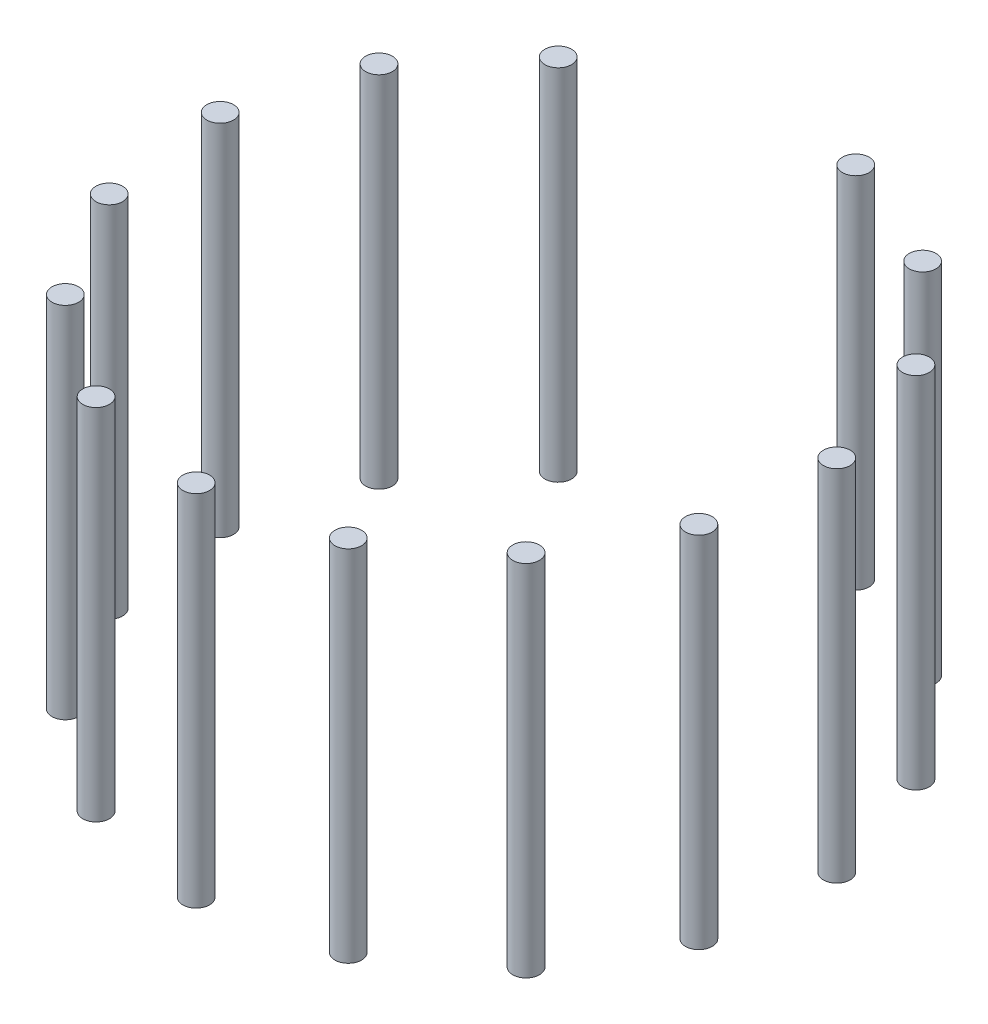
from build123d import *

# Parameters (mm, degrees)
SKETCH1_R              = 0.35
BOSS_EXTRUDE1_DEPTH    = 9.4
BOSS_EXTRUDE1_2_DEPTH  = 9.4
BOSS_EXTRUDE1_3_DEPTH  = 9.4
BOSS_EXTRUDE1_4_DEPTH  = 9.4
BOSS_EXTRUDE1_5_DEPTH  = 9.4
BOSS_EXTRUDE1_6_DEPTH  = 9.4
BOSS_EXTRUDE1_7_DEPTH  = 9.4
BOSS_EXTRUDE1_8_DEPTH  = 9.4
BOSS_EXTRUDE1_9_DEPTH  = 9.4
BOSS_EXTRUDE1_10_DEPTH = 9.4
BOSS_EXTRUDE1_11_DEPTH = 9.4
BOSS_EXTRUDE1_12_DEPTH = 9.4
BOSS_EXTRUDE1_13_DEPTH = 9.4
BOSS_EXTRUDE1_14_DEPTH = 9.4


with BuildPart() as part:
    # Sketch1 → Boss-Extrude1 (new body)
    with BuildSketch(Plane(origin=(0, 0, 0), x_dir=(1, 0, 0), z_dir=(0, 1, 0))):
        with Locations(Location((15.176802475, 8.12525881, 0), (0, 0, 270))):
            Circle(SKETCH1_R)
    extrude(amount=BOSS_EXTRUDE1_DEPTH)


with BuildPart() as body_2:
    # Sketch1 → Boss-Extrude1 2 (new body)
    with BuildSketch(Plane(origin=(0, 0, 0), x_dir=(1, 0, 0), z_dir=(0, 1, 0))):
        with Locations(Location((18.235691658, 6.817826829, 0), (0, 0, 270))):
            Circle(SKETCH1_R)
    extrude(amount=BOSS_EXTRUDE1_2_DEPTH)


with BuildPart() as body_3:
    # Sketch1 → Boss-Extrude1 3 (new body)
    with BuildSketch(Plane(origin=(0, 0, 0), x_dir=(1, 0, 0), z_dir=(0, 1, 0))):
        with Locations(Location((20.498345482, 4.379265963, 0), (0, 0, 270))):
            Circle(SKETCH1_R)
    extrude(amount=BOSS_EXTRUDE1_3_DEPTH)


with BuildPart() as body_4:
    # Sketch1 → Boss-Extrude1 4 (new body)
    with BuildSketch(Plane(origin=(0, 0, 0), x_dir=(1, 0, 0), z_dir=(0, 1, 0))):
        with Locations(Location((21.573530543, 1.23122554, 0), (0, 0, 270))):
            Circle(SKETCH1_R)
    extrude(amount=BOSS_EXTRUDE1_4_DEPTH)


with BuildPart() as body_5:
    # Sketch1 → Boss-Extrude1 5 (new body)
    with BuildSketch(Plane(origin=(0, 0, 0), x_dir=(1, 0, 0), z_dir=(0, 1, 0))):
        with Locations(Location((21.275337579, -2.081969652, 0), (0, 0, 270))):
            Circle(SKETCH1_R)
    extrude(amount=BOSS_EXTRUDE1_5_DEPTH)


with BuildPart() as body_6:
    # Sketch1 → Boss-Extrude1 6 (new body)
    with BuildSketch(Plane(origin=(0, 0, 0), x_dir=(1, 0, 0), z_dir=(0, 1, 0))):
        with Locations(Location((19.655326861, -4.987438064, 0), (0, 0, 270))):
            Circle(SKETCH1_R)
    extrude(amount=BOSS_EXTRUDE1_6_DEPTH)


with BuildPart() as body_7:
    # Sketch1 → Boss-Extrude1 7 (new body)
    with BuildSketch(Plane(origin=(0, 0, 0), x_dir=(1, 0, 0), z_dir=(0, 1, 0))):
        with Locations(Location((16.993612959, -6.982797813, 0), (0, 0, 270))):
            Circle(SKETCH1_R)
    extrude(amount=BOSS_EXTRUDE1_7_DEPTH)


with BuildPart() as body_8:
    # Sketch1 → Boss-Extrude1 8 (new body)
    with BuildSketch(Plane(origin=(0, 0, 0), x_dir=(1, 0, 0), z_dir=(0, 1, 0))):
        with Locations(Location((13.750430389, -7.723033071, 0), (0, 0, 270))):
            Circle(SKETCH1_R)
    extrude(amount=BOSS_EXTRUDE1_8_DEPTH)


with BuildPart() as body_9:
    # Sketch1 → Boss-Extrude1 9 (new body)
    with BuildSketch(Plane(origin=(0, 0, 0), x_dir=(1, 0, 0), z_dir=(0, 1, 0))):
        with Locations(Location((10.48655488, -7.080150437, 0), (0, 0, 270))):
            Circle(SKETCH1_R)
    extrude(amount=BOSS_EXTRUDE1_9_DEPTH)


with BuildPart() as body_10:
    # Sketch1 → Boss-Extrude1 10 (new body)
    with BuildSketch(Plane(origin=(0, 0, 0), x_dir=(1, 0, 0), z_dir=(0, 1, 0))):
        with Locations(Location((7.766340158, -5.165310159, 0), (0, 0, 270))):
            Circle(SKETCH1_R)
    extrude(amount=BOSS_EXTRUDE1_10_DEPTH)


with BuildPart() as body_11:
    # Sketch1 → Boss-Extrude1 11 (new body)
    with BuildSketch(Plane(origin=(0, 0, 0), x_dir=(1, 0, 0), z_dir=(0, 1, 0))):
        with Locations(Location((6.060136062, -2.309605516, 0), (0, 0, 270))):
            Circle(SKETCH1_R)
    extrude(amount=BOSS_EXTRUDE1_11_DEPTH)


with BuildPart() as body_12:
    # Sketch1 → Boss-Extrude1 12 (new body)
    with BuildSketch(Plane(origin=(0, 0, 0), x_dir=(1, 0, 0), z_dir=(0, 1, 0))):
        with Locations(Location((5.662960781, 0.993186215, 0), (0, 0, 270))):
            Circle(SKETCH1_R)
    extrude(amount=BOSS_EXTRUDE1_12_DEPTH)


with BuildPart() as body_13:
    # Sketch1 → Boss-Extrude1 13 (new body)
    with BuildSketch(Plane(origin=(0, 0, 0), x_dir=(1, 0, 0), z_dir=(0, 1, 0))):
        with Locations(Location((6.643489528, 4.171982339, 0), (0, 0, 270))):
            Circle(SKETCH1_R)
    extrude(amount=BOSS_EXTRUDE1_13_DEPTH)


with BuildPart() as body_14:
    # Sketch1 → Boss-Extrude1 14 (new body)
    with BuildSketch(Plane(origin=(0, 0, 0), x_dir=(1, 0, 0), z_dir=(0, 1, 0))):
        with Locations(Location((8.832179975, 6.677140127, 0), (0, 0, 270))):
            Circle(SKETCH1_R)
    extrude(amount=BOSS_EXTRUDE1_14_DEPTH)


solid = Compound([part.part, body_2.part, body_3.part, body_4.part, body_5.part, body_6.part, body_7.part, body_8.part, body_9.part, body_10.part, body_11.part, body_12.part, body_13.part, body_14.part])
